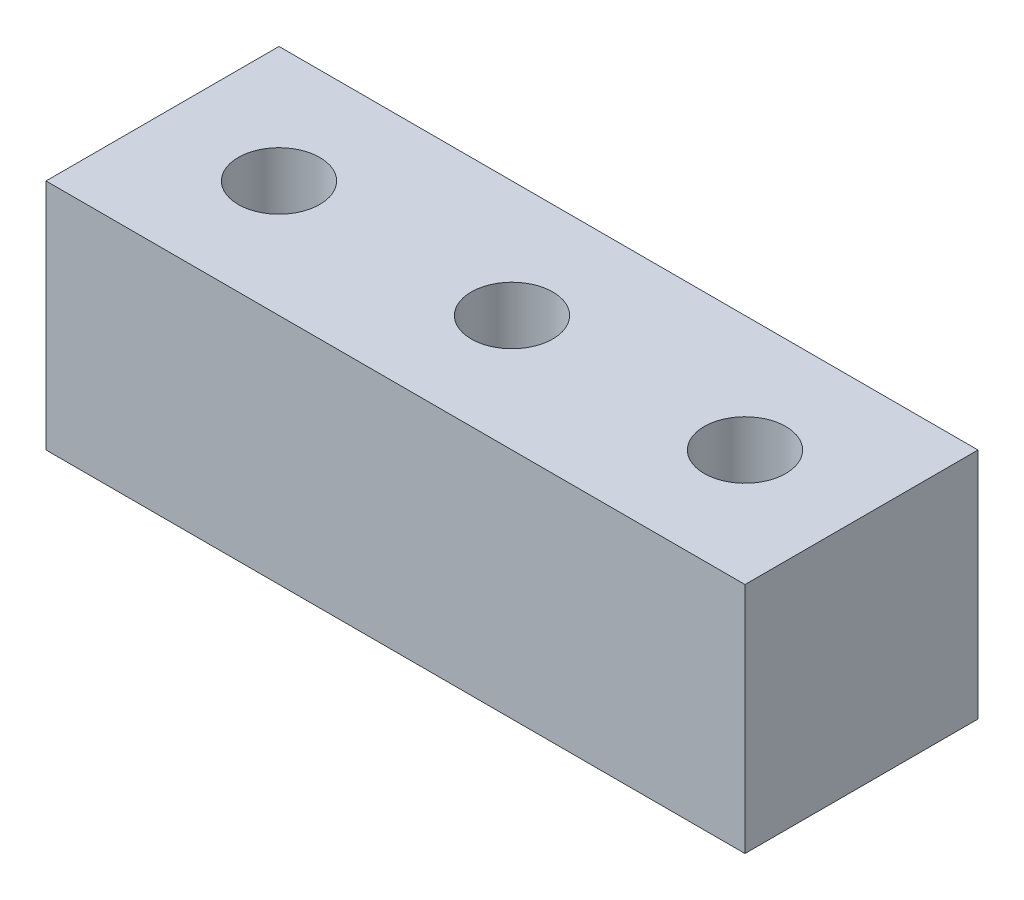
from build123d import *

# Parameters (mm, degrees)
SKETCH1_W           = 36
SKETCH1_H           = 12
SKETCH1_R           = 2.1
BOSS_EXTRUDE1_DEPTH = 12
SKETCH1_2_R         = 2.1
BOSS_EXTRUDE2_DEPTH = 2


with BuildPart() as part:
    # Sketch1 → Boss-Extrude1 (new body)
    with BuildSketch(Plane(origin=(0, 0, 0), x_dir=(1, 0, 0), z_dir=(0, 1, 0))):
        Rectangle(SKETCH1_W, SKETCH1_H)
        Circle(SKETCH1_R, mode=Mode.SUBTRACT)
        with Locations((-12, 0)):
            Circle(SKETCH1_R, mode=Mode.SUBTRACT)
        with Locations((12, 0)):
            Circle(SKETCH1_R, mode=Mode.SUBTRACT)
    extrude(amount=BOSS_EXTRUDE1_DEPTH)

    # Sketch1<2> → Boss-Extrude2 (add)
    with BuildSketch(Plane(origin=(0, 0, 0), x_dir=(1, 0, 0), z_dir=(0, 1, 0))):
        Circle(SKETCH1_2_R)
        with Locations((-12, 0)):
            Circle(SKETCH1_2_R)
        with Locations((12, 0)):
            Circle(SKETCH1_2_R)
    extrude(amount=BOSS_EXTRUDE2_DEPTH)


solid = part.part
